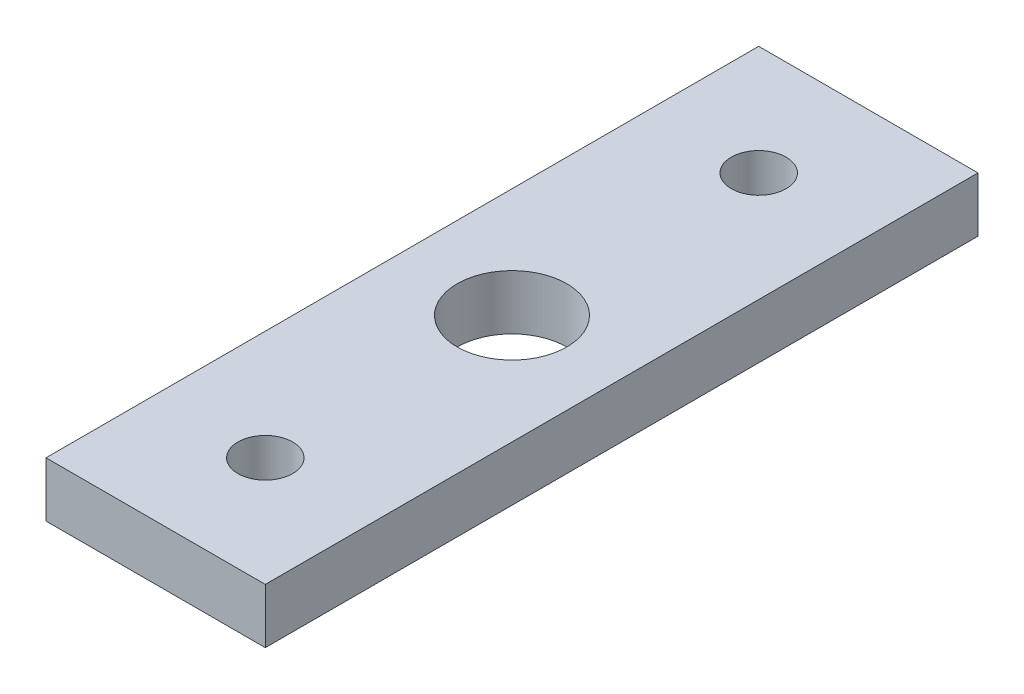
from build123d import *

# Parameters (mm, degrees)
SKETCH1_W           = 25.4
SKETCH1_H           = 82.55
SKETCH1_R           = 6.35
SKETCH1_R_2         = 3.175
BOSS_EXTRUDE1_DEPTH = 6.35


with BuildPart() as part:
    # Sketch1 → Boss-Extrude1 (new body)
    with BuildSketch(Plane(origin=(0, 0, 0), x_dir=(1, 0, 0), z_dir=(0, 1, 0))):
        Rectangle(SKETCH1_W, SKETCH1_H)
        with Locations(Location((0, 0, 0), (0, 0, 270))):
            Circle(SKETCH1_R, mode=Mode.SUBTRACT)
        with Locations(Location((0, 28.575, 0), (0, 0, 270))):
            Circle(SKETCH1_R_2, mode=Mode.SUBTRACT)
        with Locations(Location((0, -28.575, 0), (0, 0, 90))):
            Circle(SKETCH1_R_2, mode=Mode.SUBTRACT)
    extrude(amount=BOSS_EXTRUDE1_DEPTH)


solid = part.part
